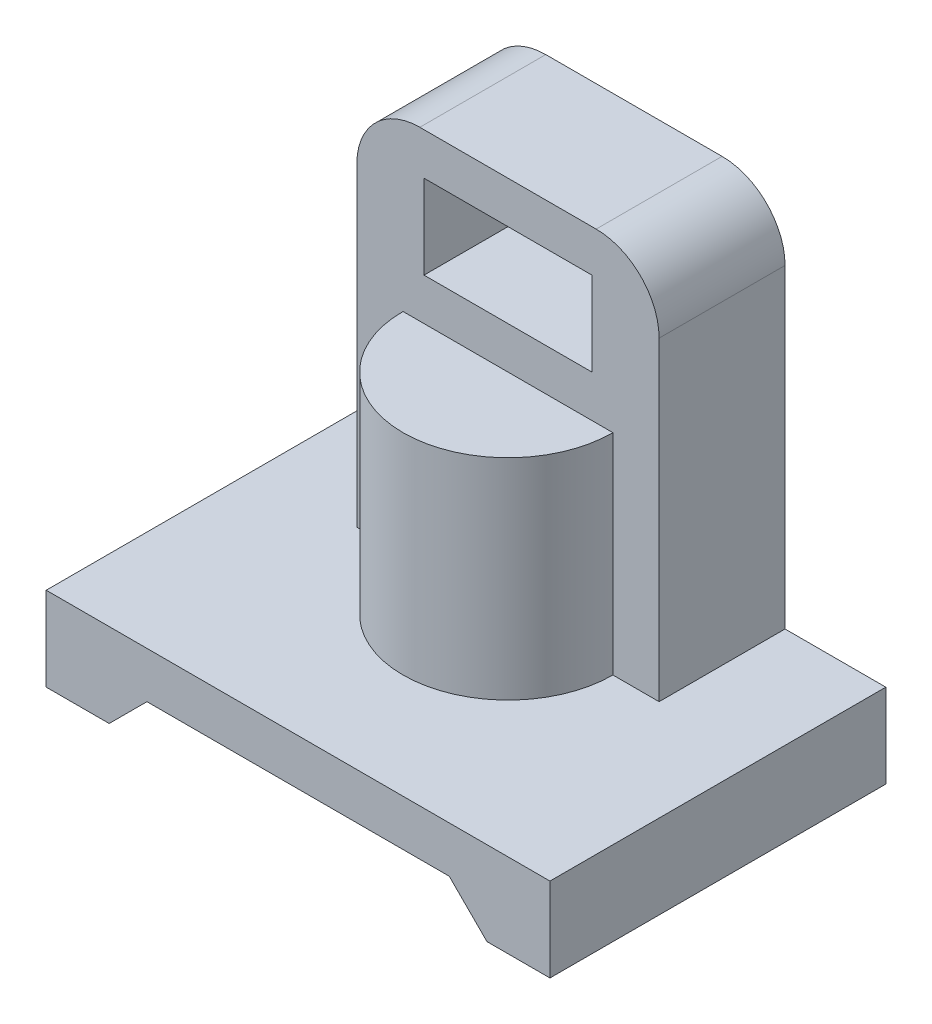
from build123d import *

# Parameters (mm, degrees)
SKETCH_1_W               = 120
SKETCH_1_H               = 80
EXTRUDE_1_DEPTH          = 20
CUT_EXTRUDE_1_DEPTH      = 146.602197786
CUT_EXTRUDE_1_DEPTH_BACK = 146.602197786
SKETCH_3_W               = 72
SKETCH_3_H               = 30
EXTRUDE_2_DEPTH          = 90
EXTRUDE_3_DEPTH          = 50
FILLET_1_R               = 15
CUT_EXTRUDE_2_DEPTH      = 171.293863659
CUT_EXTRUDE_2_DEPTH_BACK = 171.293863659
SKETCH_5_W               = 40
SKETCH_5_H               = 20


with BuildPart() as part:
    # 草图1 → 凸台-拉伸1 (new body)
    with BuildSketch(Plane(origin=(0, 0, 0), x_dir=(1, 0, 0), z_dir=(0, 1, 0))):
        with Locations((60, -40)):
            Rectangle(SKETCH_1_W, SKETCH_1_H)
    extrude(amount=EXTRUDE_1_DEPTH)

    # 草图2 → 切除-拉伸1 (cut, two sides: drawn at the far end of the back side and taken through both)
    with BuildSketch(Plane.XY.offset(80).offset(-CUT_EXTRUDE_1_DEPTH_BACK)):
        Polygon((60, 0), (105, 0), (96, 9), (57.005784519, 9), (24, 9), (15, 0), align=None)
    extrude(amount=CUT_EXTRUDE_1_DEPTH + CUT_EXTRUDE_1_DEPTH_BACK, mode=Mode.SUBTRACT)

    # 草图3 → 凸台-拉伸2 (add)
    with BuildSketch(Plane(origin=(0, 20, 0), x_dir=(1, 0, 0), z_dir=(0, 1, 0))):
        with Locations((60, -15)):
            Rectangle(SKETCH_3_W, SKETCH_3_H)
    extrude(amount=EXTRUDE_2_DEPTH)

    # 草图3<3> → 凸台-拉伸3 (add)
    with BuildSketch(Plane(origin=(0, 20, 0), x_dir=(1, 0, 0), z_dir=(0, 1, 0))):
        with BuildLine():
            Line((80, -30), (60, -30))
            Line((60, -30), (49.673358607, -30))
            Line((49.673358607, -30), (40, -30))
            Line((40, -30), (35, -30))
            ThreePointArc((35, -30), (60, -55), (85, -30))
            Line((85, -30), (80, -30))
        make_face()
    extrude(amount=EXTRUDE_3_DEPTH)

    # 圆角1
    fillet_1_edges = [part.edges().sort_by_distance(p)[0] for p in [
        (96, 110, 15),
        (24, 110, 15),
    ]]
    fillet(fillet_1_edges, radius=FILLET_1_R)

    # 草图5 → 切除-拉伸2 (cut, two sides: drawn at the far end of the back side and taken through both)
    with BuildSketch(Plane.XY.offset(30).offset(-CUT_EXTRUDE_2_DEPTH_BACK)):
        with Locations((60, 90)):
            Rectangle(SKETCH_5_W, SKETCH_5_H)
    extrude(amount=CUT_EXTRUDE_2_DEPTH + CUT_EXTRUDE_2_DEPTH_BACK, mode=Mode.SUBTRACT)


solid = part.part
